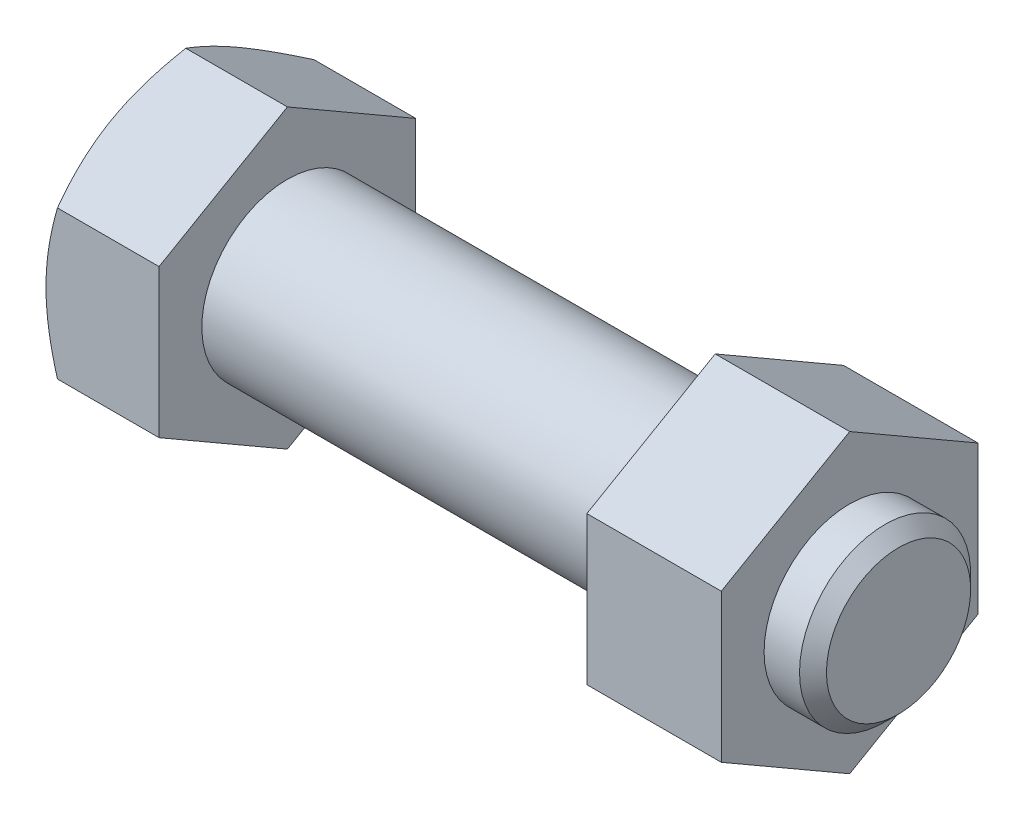
from build123d import *

# Parameters (mm, degrees)
BASEHEAD_DEPTH      = 9.25
BOSS_EXTRUDE1_DEPTH = 11


with BuildPart() as part:
    # Sketch1 → BaseHead (new body)
    with BuildSketch(Plane(origin=(0, 0, 0), x_dir=(0, 0, -1), z_dir=(1, 0, 0))):
        Polygon((10.5, 6.062177826), (10.5, -6.062177826), (0, -12.124355653), (-10.5, -6.062177826), (-10.5, 6.062177826), (0, 12.124355653), align=None)
    extrude(amount=BASEHEAD_DEPTH)

    # BodySke → BaseBody (revolve)
    with BuildSketch(Plane.XY, mode=Mode.PRIVATE) as basebody_sk:
        Polygon((0, 0), (59.25, 0), (59.25, 5.8985), (58.1485, 7), (0, 7), align=None)
    revolve(basebody_sk.sketch.rotate(Axis((0, 0, 0), (1, 0, 0)), 90), axis=Axis((0, 0, 0), (1, 0, 0)))

    # Sketch3 → HeadChamfer (revolve, cut)
    with BuildSketch(Plane.XY):
        Polygon((0, 10.5), (3.824573519, 17.124355653), (3.824573519, 22.124355653), (-10, 22.124355653), (-10, 10.5), align=None)
    revolve(axis=Axis((0, 0, 0), (1, 0, 0)), mode=Mode.SUBTRACT)

    # Sketch4 → Boss-Extrude1 (add)
    with BuildSketch(Plane(origin=(44.25, 0, 0), x_dir=(0, 0, -1), z_dir=(1, 0, 0))):
        Polygon((0, 12.124355653), (-10.5, 6.062177826), (-10.5, -6.062177826), (0, -12.124355653), (10.5, -6.062177826), (10.5, 6.062177826), align=None)
    extrude(amount=BOSS_EXTRUDE1_DEPTH)


solid = part.part
